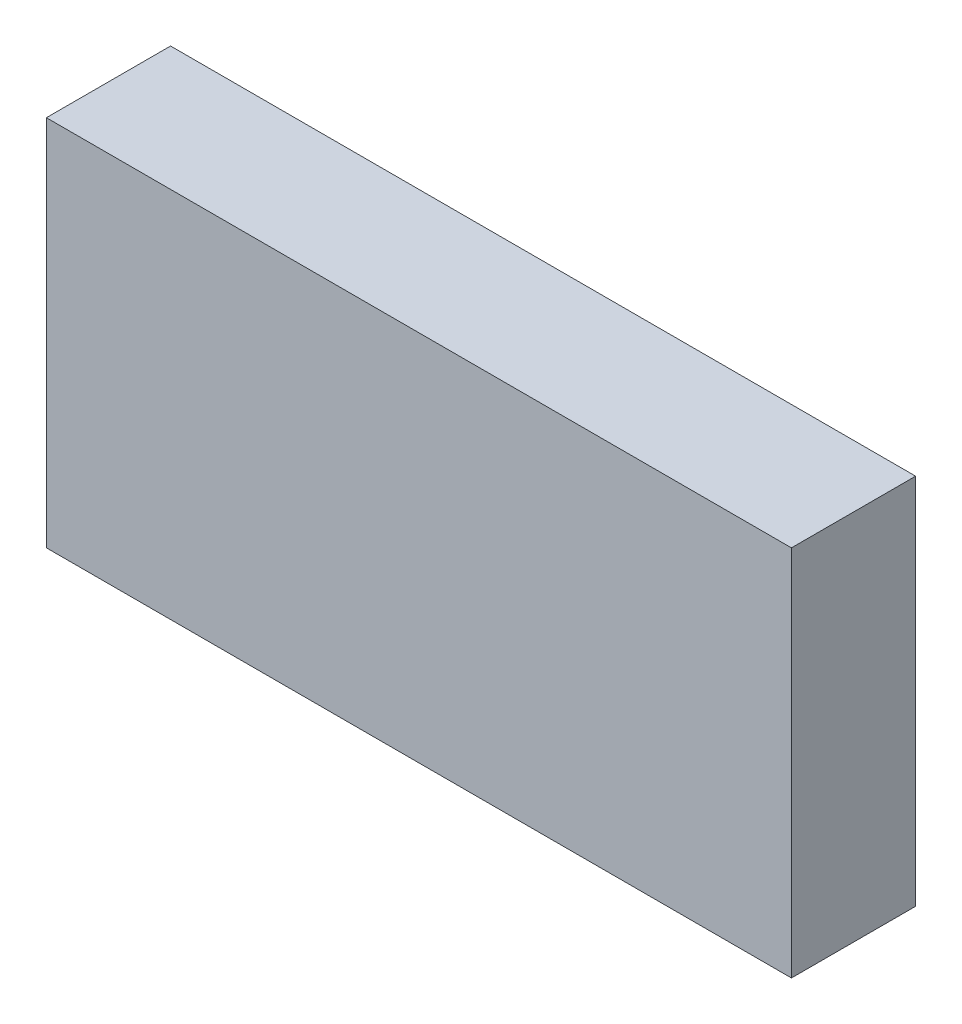
from build123d import *

# Parameters (mm, degrees)
SKETCH2_W           = 19.05
SKETCH2_H           = 9.525
BOSS_EXTRUDE1_DEPTH = 3.175


with BuildPart() as part:
    # Sketch2 → Boss-Extrude1 (new body)
    with BuildSketch(Plane.XY):
        Rectangle(SKETCH2_W, SKETCH2_H)
    extrude(amount=BOSS_EXTRUDE1_DEPTH)


solid = part.part
